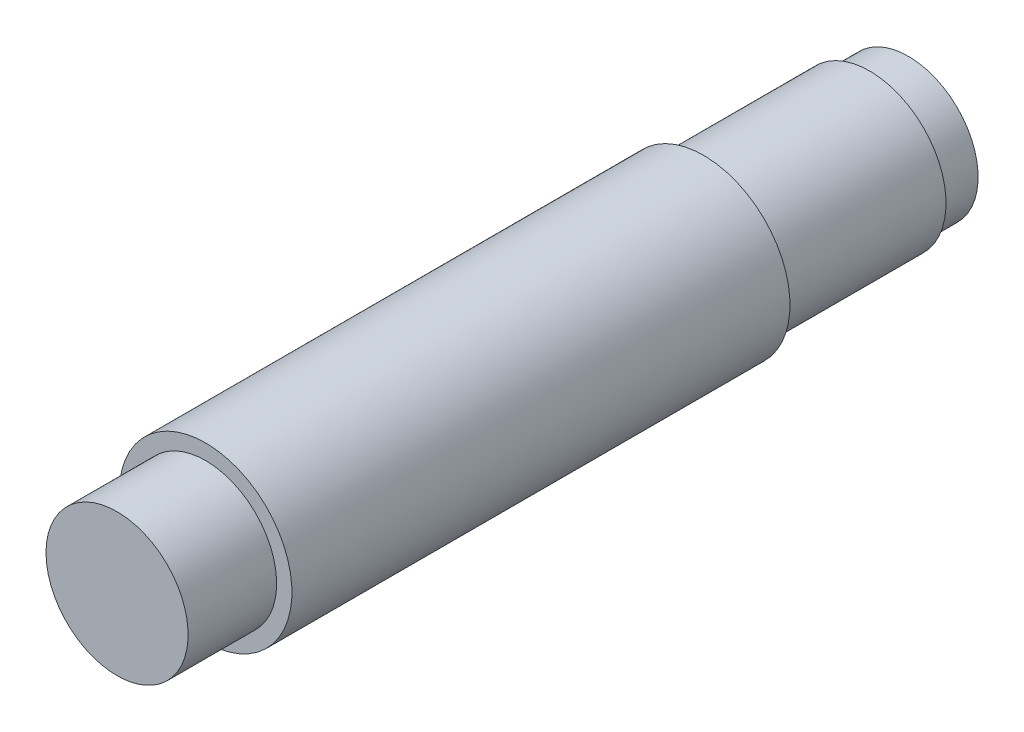
from build123d import *


with BuildPart() as part:
    # Sketch2 → Revolve2 (revolve)
    with BuildSketch(Plane(origin=(0, 0, 0), x_dir=(1, 0, 0), z_dir=(0, 1, 0)), mode=Mode.PRIVATE) as revolve2_sk:
        Polygon((0, 11.183798979), (0, -24.566201021), (3.21, -24.566201021), (3.21, -20.566201021), (3.9, -20.566201021), (3.9, 1.933798979), (3.45, 1.933798979), (3.45, 9.433798979), (3.15, 9.433798979), (3.15, 11.183798979), align=None)
    revolve(revolve2_sk.sketch.rotate(Axis((0, 0, -14.019023545), (0, 0, 1)), 180), axis=Axis((0, 0, -14.019023545), (0, 0, 1)))


solid = part.part
